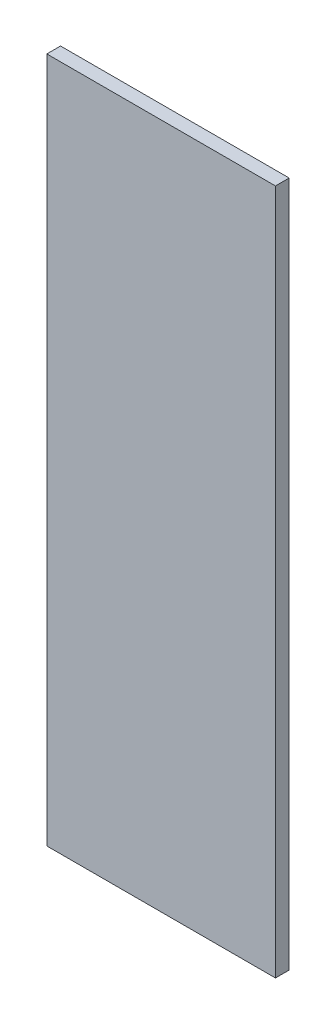
from build123d import *

# Parameters (mm, degrees)
SKETCH1_W           = 500
SKETCH1_H           = 1500
BOSS_EXTRUDE1_DEPTH = 30


with BuildPart() as part:
    # Sketch1 → Boss-Extrude1 (new body)
    with BuildSketch(Plane.XY):
        with Locations((0, -107.462689126)):
            Rectangle(SKETCH1_W, SKETCH1_H)
    extrude(amount=BOSS_EXTRUDE1_DEPTH)


solid = part.part
